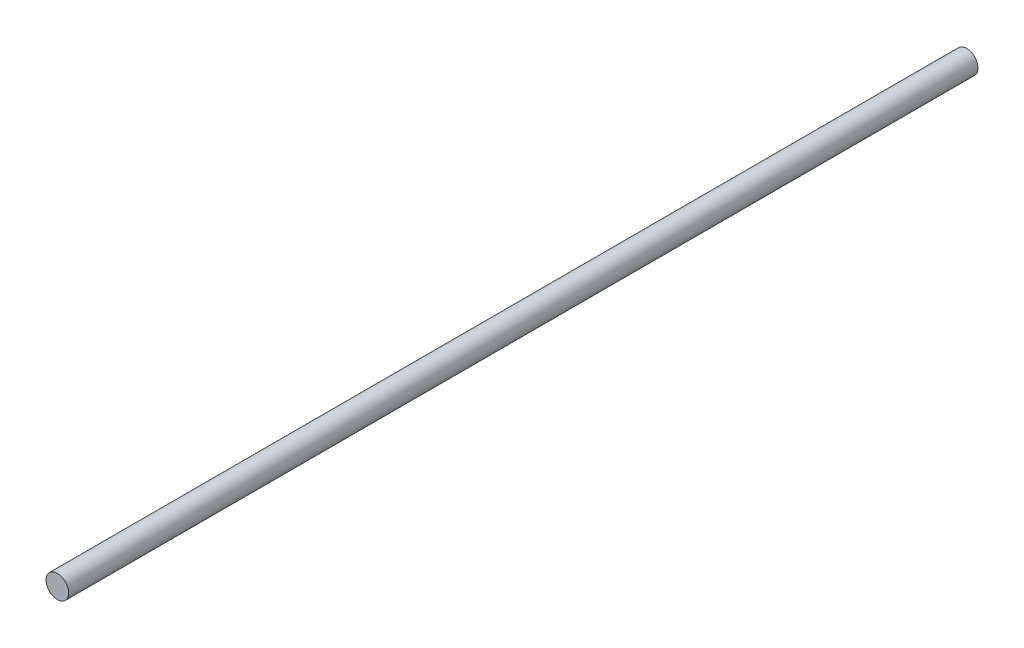
from build123d import *

# Parameters (mm, degrees)
SKETCH1_R           = 2
BOSS_EXTRUDE1_DEPTH = 160


with BuildPart() as part:
    # Sketch1 → Boss-Extrude1 (new body)
    with BuildSketch(Plane.XY):
        Circle(SKETCH1_R)
    extrude(amount=BOSS_EXTRUDE1_DEPTH)


solid = part.part
